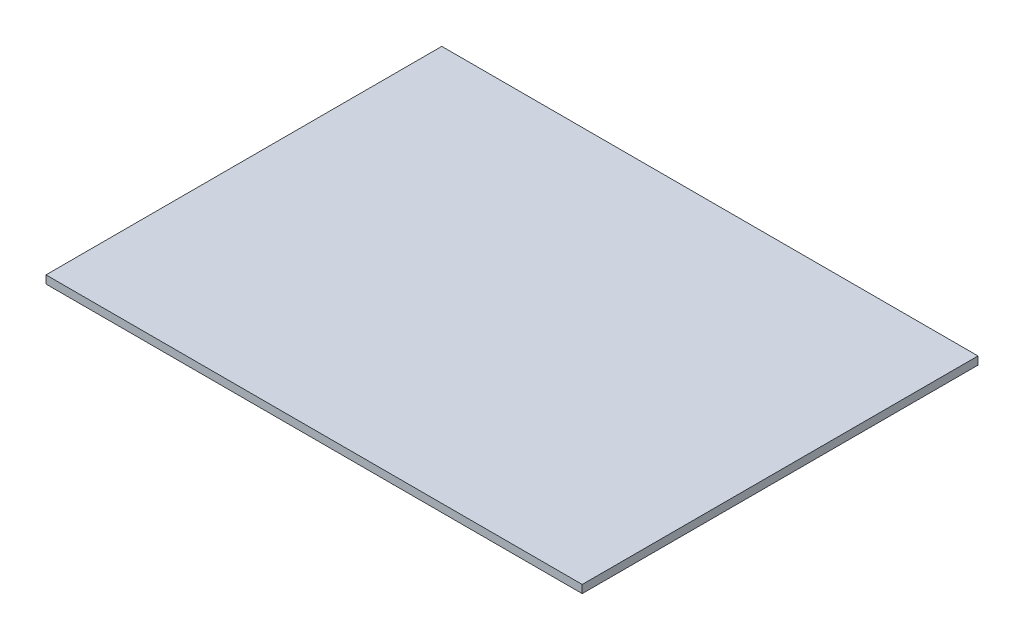
from build123d import *

# Parameters (mm, degrees)
BOSS_EXTRUDE1_DEPTH = 5


with BuildPart() as part:
    # Sketch1 → Boss-Extrude1 (new body)
    with BuildSketch(Plane(origin=(0, 0, 0), x_dir=(1, 0, 0), z_dir=(0, 1, 0))):
        Polygon((-148, 124), (-166.974336391, 124), (-166.974336391, -124), (-148, -124), (148, -124), (169.025663609, -124), (169.025663609, 124), (148, 124), align=None)
    extrude(amount=BOSS_EXTRUDE1_DEPTH)


solid = part.part
